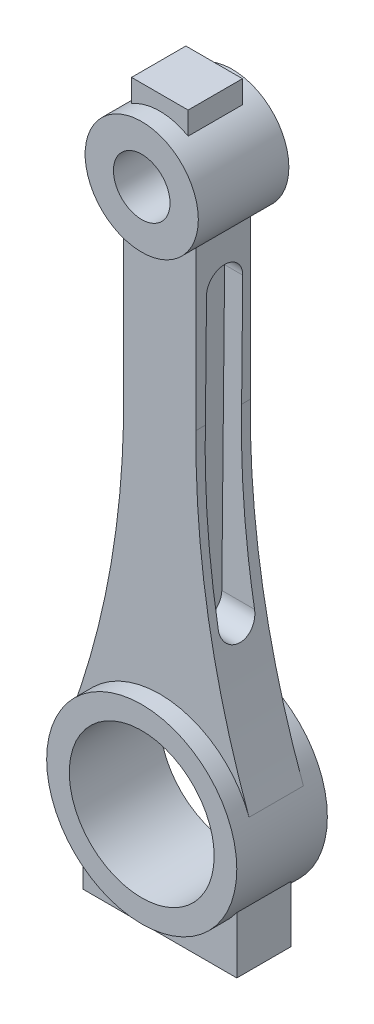
from build123d import *

# Parameters (mm, degrees)
SKETCH1_R             = 12.5
SKETCH1_R_2           = 6.25
BOSS_EXTRUDE2_DEPTH   = 10
SKETCH1_R_3           = 21
SKETCH1_R_4           = 16
BOSS_EXTRUDE2_2_DEPTH = 10
BOSS_EXTRUDE3_DEPTH   = 6
CUT_EXTRUDE1_START    = 4
CUT_EXTRUDE1_DEPTH    = 140.802456026


with BuildPart() as part:
    # Sketch1 → Boss-Extrude2 (new, symmetric)
    with BuildSketch(Plane.XY):
        with Locations((0, 120)):
            Circle(SKETCH1_R)
        with Locations((0, 120)):
            Circle(SKETCH1_R_2, mode=Mode.SUBTRACT)
    extrude(amount=BOSS_EXTRUDE2_DEPTH, both=True)



with BuildPart() as body_2:
    # Sketch1 → Boss-Extrude2 2 (new, symmetric)
    with BuildSketch(Plane.XY):
        Circle(SKETCH1_R_3)
        Circle(SKETCH1_R_4, mode=Mode.SUBTRACT)
    extrude(amount=BOSS_EXTRUDE2_2_DEPTH, both=True)


with BuildPart() as part_1:
    add(part.part)

    add(body_2.part)  # Boss-Extrude3 merges body 2
    # Sketch1<7> → Boss-Extrude3 (add, symmetric)
    with BuildSketch(Plane.XY):
        with BuildLine():
            Line((6.25, 135.825317547), (-6.25, 135.825317547))
            Line((-6.25, 135.825317547), (-6.25, 130.825317547))
            ThreePointArc((-6.25, 130.825317547), (0, 132.5), (6.25, 130.825317547))
            Line((6.25, 130.825317547), (6.25, 135.825317547))
        make_face()
        with BuildLine():
            Line((-8, 110.395313644), (-8, 75.395313644))
            ThreePointArc((-8, 75.395313644), (-10.727396888, 40.791551261), (-19.704607906, 7.261434244))
            ThreePointArc((-19.704607906, 7.261434244), (0, 21), (19.704607906, 7.261434244))
            ThreePointArc((19.704607906, 7.261434244), (10.727396888, 40.791551261), (8, 75.395313644))
            Line((8, 75.395313644), (8, 110.395313644))
            ThreePointArc((8, 110.395313644), (0, 107.5), (-8, 110.395313644))
        make_face()
        with BuildLine():
            Line((-17, -12.328828006), (-17, -24.828828006))
            Line((-17, -24.828828006), (17, -24.828828006))
            Line((17, -24.828828006), (17, -12.328828006))
            ThreePointArc((17, -12.328828006), (0, -21), (-17, -12.328828006))
        make_face()
    extrude(amount=BOSS_EXTRUDE3_DEPTH, both=True)

    # Sketch2 → Cut-Extrude1 (cut)
    with BuildSketch(Plane(origin=(0, 0, 0), x_dir=(0, 0, -1), z_dir=(1, 0, 0)).offset(CUT_EXTRUDE1_START)):
        with BuildLine():
            Line((4.310429138, 99.95992073), (3.689169265, 37.95992073))
            ThreePointArc((3.689169265, 37.95992073), (-0.350709206, 34.000200799), (-4.310429138, 38.04007927))
            Line((-4.310429138, 38.04007927), (-3.689169265, 100.04007927))
            ThreePointArc((-3.689169265, 100.04007927), (0.350709206, 103.999799201), (4.310429138, 99.95992073))
        make_face()
    cut_extrude1 = extrude(amount=CUT_EXTRUDE1_DEPTH, mode=Mode.SUBTRACT)

    # Mirror1: Cut-Extrude1 across plane
    add(cut_extrude1.mirror(Plane(origin=(0, 0, 0), x_dir=(0, 0, 1), z_dir=(1, 0, 0))), mode=Mode.SUBTRACT)


solid = part_1.part
